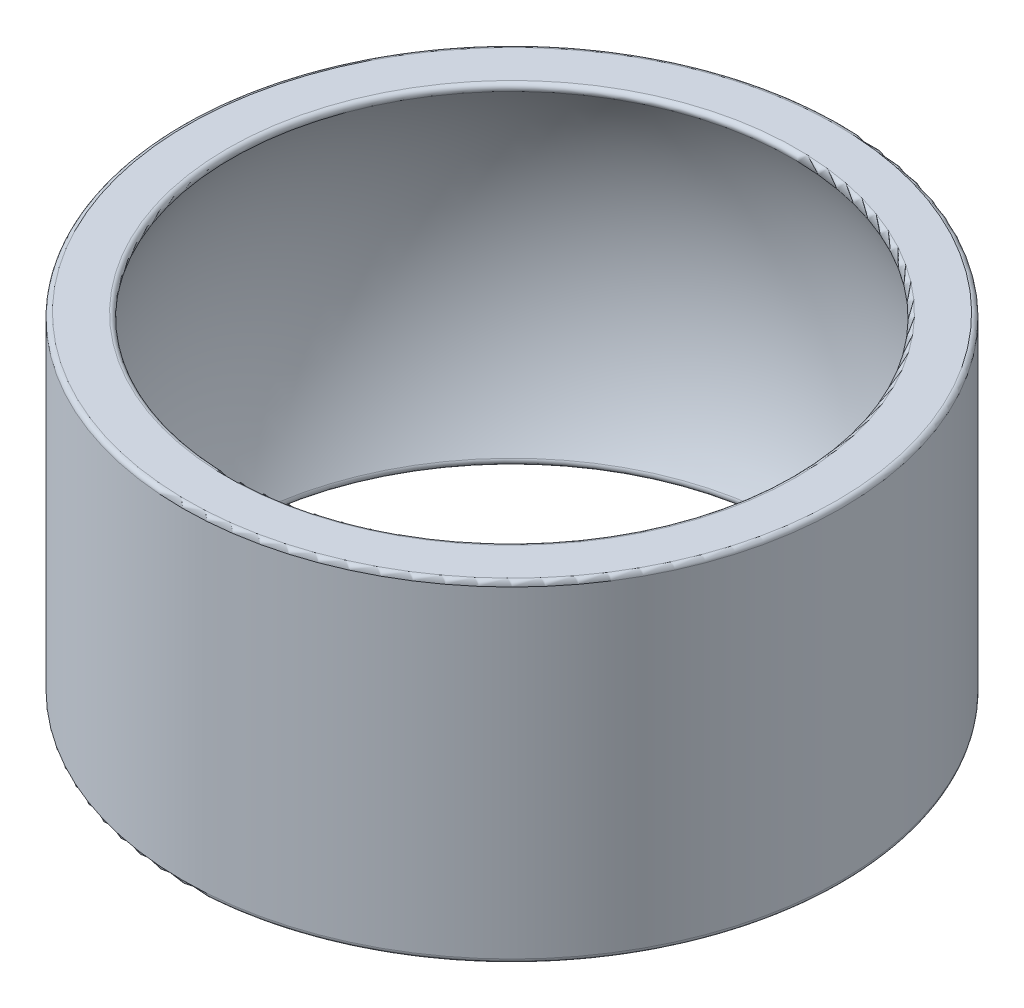
from build123d import *

# Parameters (mm, degrees)
FILLET1_R = 0.3


with BuildPart() as part:
    # Sketch1 → Revolve1 (revolve)
    with BuildSketch(Plane.XY, mode=Mode.PRIVATE) as revolve1_sk:
        with BuildLine():
            Line((18.385609182, 11), (21.891779279, 11))
            Line((21.891779279, 11), (21.891779279, -11))
            Line((21.891779279, -11), (18.385609182, -11))
            ThreePointArc((18.385609182, -11), (21.425, 0), (18.385609182, 11))
        make_face()
    revolve(revolve1_sk.sketch.rotate(Axis((0, 11, 0), (0, -1, 0)), 180), axis=Axis((0, 11, 0), (0, -1, 0)))

    # Fillet1
    fillet1_edges = [part.edges().sort_by_distance(p)[0] for p in [
        (21.891779279, -11, 0),
        (18.385609182, -11, 0),
        (18.385609182, 11, 0),
        (21.891779279, 11, 0),
    ]]
    fillet(fillet1_edges, radius=FILLET1_R)


solid = part.part
